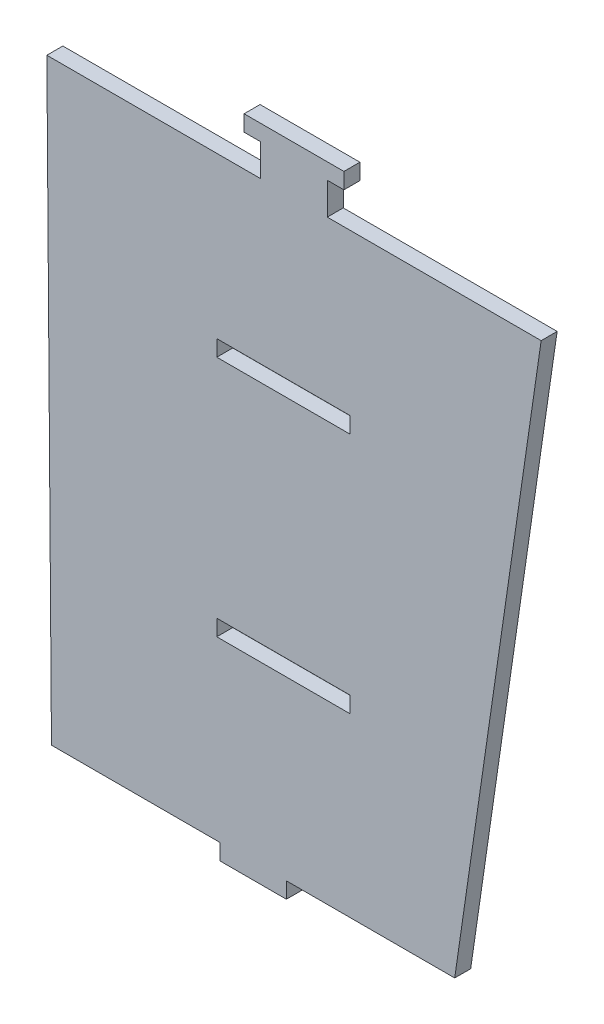
from build123d import *

# Parameters (mm, degrees)
BOSS_EXTRUDE1_DEPTH = 1.524
SKETCH2_W           = 12.7
SKETCH2_H           = 1.537730424
SKETCH2_H_2         = 1.537730425
CUT_EXTRUDE1_DEPTH  = 1.524


with BuildPart() as part:
    # Sketch1 → Boss-Extrude1 (new body)
    with BuildSketch(Plane.XY):
        Polygon((-102.477755775, -1.524), (-110.726395883, -58.314338926), (-126.787898899, -58.314338926), (-126.787898899, -59.838338926), (-133.137898899, -59.838338926), (-133.137898899, -58.314338926), (-149.199401915, -58.314338926), (-149.6392871, -1.524), (-129.233521437, -1.524), (-129.233521437, 1.524), (-130.821021437, 1.524), (-130.821021437, 3.048), (-121.296021437, 3.048), (-121.296021437, 1.524), (-122.883521437, 1.524), (-122.883521437, -1.524), align=None)
    extrude(amount=BOSS_EXTRUDE1_DEPTH)

    # Sketch2 → Cut-Extrude1 (cut)
    with BuildSketch(Plane.XY.offset(1.524)):
        with Locations((-127.078752717, -17.602011312)):
            Rectangle(SKETCH2_W, SKETCH2_H)
        with Locations((-127.078752717, -40.703047377)):
            Rectangle(SKETCH2_W, SKETCH2_H_2)
    extrude(amount=-CUT_EXTRUDE1_DEPTH, mode=Mode.SUBTRACT)


solid = part.part
